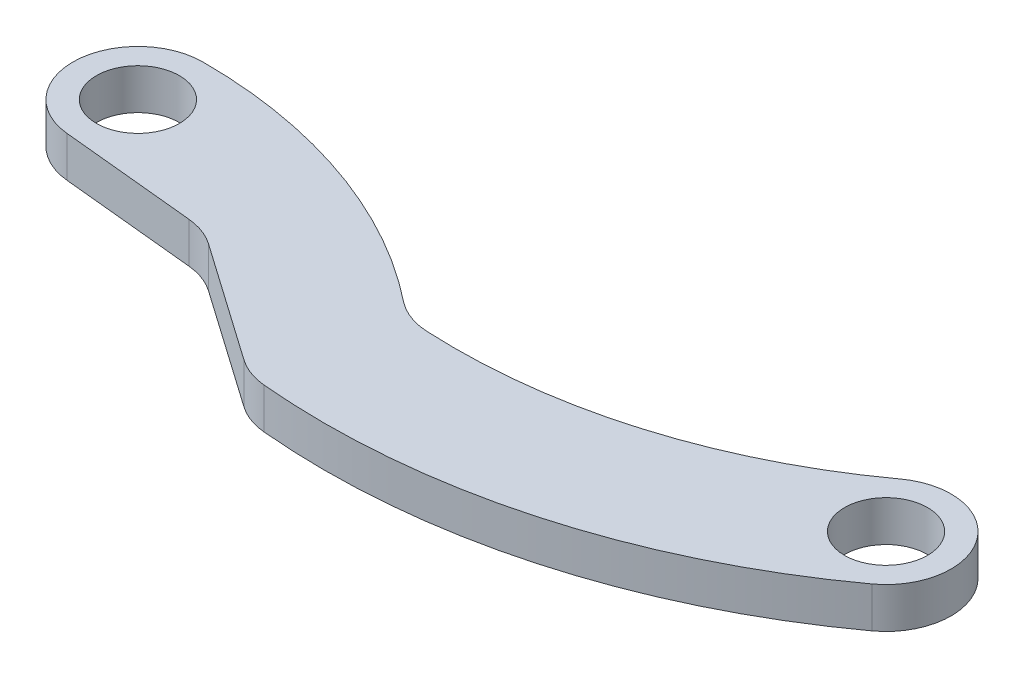
from build123d import *

# Parameters (mm, degrees)
SKETCH_1_R      = 5.1
EXTRUDE_1_DEPTH = 5
FILLET_1_R      = 8


with BuildPart() as part:
    # 草图1 → 凸台-拉伸1 (new body)
    with BuildSketch(Plane(origin=(0, 0, 0), x_dir=(1, 0, 0), z_dir=(0, 1, 0))):
        with BuildLine():
            Line((-0.787870548, -7.961109219), (17.98227334, -9.818695034))
            Line((17.98227334, -9.818695034), (35.982367897, -22.422496932))
            ThreePointArc((35.982367897, -22.422496932), (67.859174016, -20.183513419), (96.717948718, -6.460724409))
            ThreePointArc((96.717948718, -6.460724409), (98.460724409, 4.717948718), (87.282051282, 6.460724409))
            ThreePointArc((87.282051282, 6.460724409), (64.699919143, -4.463945073), (39.716178923, -6.725320727))
            ThreePointArc((39.716178923, -6.725320727), (21.179057691, 4.200169373), (0, 8))
            ThreePointArc((0, 8), (-7.990271389, 0.394414913), (-0.787870548, -7.961109219))
        make_face()
        with Locations(Location((0, 0, 0), (0, 0, 270))):
            Circle(SKETCH_1_R, mode=Mode.SUBTRACT)
        with Locations(Location((92, 0, 0), (0, 0, 270))):
            Circle(SKETCH_1_R, mode=Mode.SUBTRACT)
    extrude(amount=EXTRUDE_1_DEPTH)

    # 圆角1
    fillet_1_edges = [part.edges().sort_by_distance(p)[0] for p in [
        (39.716178923, 2.5, 6.725320727),
        (35.982367897, 2.5, 22.422496932),
        (17.98227334, 2.5, 9.818695034),
    ]]
    fillet(fillet_1_edges, radius=FILLET_1_R)


solid = part.part
